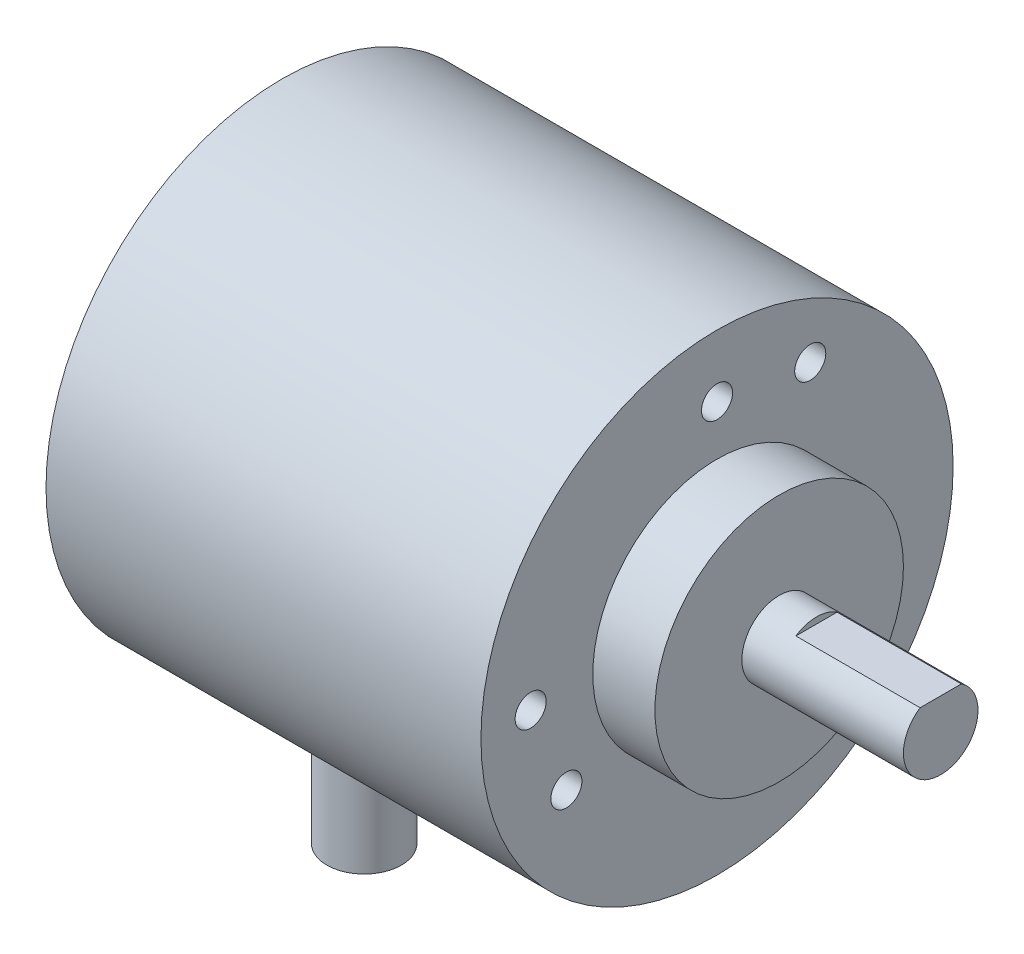
from build123d import *
from build123d.topology import SkipClean

# Parameters (mm, degrees)
SKETCH1_R                            = 19
BOSS_EXTRUDE1_DEPTH                  = 35
SKETCH2_R                            = 10
BOSS_EXTRUDE2_DEPTH                  = 5
SKETCH3_R                            = 3
BOSS_EXTRUDE3_DEPTH                  = 13
SKETCH4_W                            = 10.869693714
SKETCH4_H                            = 3.318117029
CUT_EXTRUDE1_DEPTH                   = 10
SKETCH5_R                            = 5
BOSS_EXTRUDE4_DEPTH                  = 2
BOSS_EXTRUDE4_DIRECTION_2_REACH      = 69.926
BOSS_EXTRUDE4_DIRECTION_2_END_RADIUS = 19
SKETCH6_R                            = 3
BOSS_EXTRUDE5_DEPTH                  = 10
M3_TAPPED_HOLE1_AT_2_COUNT           = 2
M3_TAPPED_HOLE1_AT_2_PITCH           = 7.567650257
CIRPATTERN1_COUNT                    = 3


with BuildPart() as part:
    # Sketch1 → Boss-Extrude1 (new body)
    with BuildSketch(Plane(origin=(0, 0, 0), x_dir=(0, 0, -1), z_dir=(1, 0, 0))):
        Circle(SKETCH1_R)
    extrude(amount=BOSS_EXTRUDE1_DEPTH)

    # Sketch2 → Boss-Extrude2 (add)
    with BuildSketch(Plane(origin=(35, 0, 0), x_dir=(0, 0, -1), z_dir=(1, 0, 0))):
        Circle(SKETCH2_R)
    extrude(amount=BOSS_EXTRUDE2_DEPTH)

    # Sketch3 → Boss-Extrude3 (add)
    with BuildSketch(Plane(origin=(40, 0, 0), x_dir=(0, 0, -1), z_dir=(1, 0, 0))):
        with Locations(Location((0, 0, 0), (0, 0, 180))):
            Circle(SKETCH3_R)
    extrude(amount=BOSS_EXTRUDE3_DEPTH)

    # Sketch4 → Cut-Extrude1 (cut)
    with BuildSketch(Plane(origin=(53, 0, 0), x_dir=(0, 0, -1), z_dir=(1, 0, 0))):
        with Locations((-0.046103434, 4.159058514)):
            Rectangle(SKETCH4_W, SKETCH4_H)
    extrude(amount=-CUT_EXTRUDE1_DEPTH, mode=Mode.SUBTRACT)

    # Sketch5 → Boss-Extrude4 (add)
    with BuildSketch(Plane(origin=(0, -19, 0), x_dir=(-1, 0, 0), z_dir=(0, -1, 0))):
        with Locations(Location((-6.604465085, 0, 0), (0, 0, 270))):
            Circle(SKETCH5_R)
    extrude(amount=BOSS_EXTRUDE4_DEPTH)

    # Boss-Extrude4 direction 2: up to this cylinder (the profile starts outside it)
    with SkipClean():  # the faces are left unmerged after this step: merging them gives an invalid solid
        boss_extrude4_direction_2_end = Plane(origin=(6.604465, 0, 0), z_dir=(-1, 0, 0)) * Cylinder(BOSS_EXTRUDE4_DIRECTION_2_END_RADIUS, 178.852, mode=Mode.PRIVATE)
        # Sketch5 → Boss-Extrude4 direction 2 (add, up to the surface)
        with BuildSketch(Plane(origin=(0, -19, 0), x_dir=(-1, 0, 0), z_dir=(0, -1, 0)), mode=Mode.PRIVATE) as boss_extrude4_direction_2_sk1:
            with Locations(Location((-6.604465085, 0, 0), (0, 0, 270))):
                Circle(SKETCH5_R)
        boss_extrude4_direction_2_tool1 = extrude(boss_extrude4_direction_2_sk1.sketch, amount=-BOSS_EXTRUDE4_DIRECTION_2_REACH, mode=Mode.PRIVATE) - boss_extrude4_direction_2_end
        add(boss_extrude4_direction_2_tool1.solids().sort_by_distance((6.604465, -19, 0))[0])
        add(boss_extrude4_direction_2_tool1.solids().sort_by_distance((6.604465, -19, 0))[1])

    # Sketch6 → Boss-Extrude5 (add)
    with BuildSketch(Plane.XZ.offset(21)):
        with Locations(Location((6.604465085, 0, 0), (0, 0, 270))):
            Circle(SKETCH6_R)
    extrude(amount=BOSS_EXTRUDE5_DEPTH)

    # Sketch10 → M3 Tapped Hole1 (revolve, cut)
    with BuildSketch(Plane(origin=(35, 12.990381057, -7.5), x_dir=(0, 0, -1), z_dir=(0, 1, 0))):
        Polygon((0, 0), (0, 8.251075774), (1.25, 7.5), (1.25, 0), align=None)
    m3_tapped_hole1 = revolve(axis=Axis((41.35, 12.990381057, -7.5), (-1, 0, 0)), mode=Mode.SUBTRACT)

    # M3 Tapped Hole1 at 2: M3 Tapped Hole1 ×2
    with Locations(*[Vector(0, 0.13341247401263537, 0.9910605994477977) * (i * M3_TAPPED_HOLE1_AT_2_PITCH) for i in range(1, M3_TAPPED_HOLE1_AT_2_COUNT)]):
        add(m3_tapped_hole1, mode=Mode.SUBTRACT)

    # CirPattern1: M3 Tapped Hole1 ×3 about axis
    cirpattern1_axis = Axis((0, 0, 0), (1, 0, 0))
    for i in range(1, CIRPATTERN1_COUNT):
        add(m3_tapped_hole1.rotate(cirpattern1_axis, i * 360 / CIRPATTERN1_COUNT), mode=Mode.SUBTRACT)

    # CirPattern1 copy 1 sketch → CirPattern1 copy 1 (revolve, cut)
    with BuildSketch(Plane(origin=(35, -7, 12.124355653), x_dir=(0, 0.8660254037844387, 0.4999999999999998), z_dir=(0, -0.4999999999999998, 0.8660254037844387))):
        Polygon((0, 0), (0, 8.251075774), (1.25, 7.5), (1.25, 0), align=None)
    revolve(axis=Axis((41.35, -7, 12.124355653), (-1, 0, 0)), mode=Mode.SUBTRACT)

    # CirPattern1 copy 2 sketch → CirPattern1 copy 2 (revolve, cut)
    with BuildSketch(Plane(origin=(35, -7, -12.124355653), x_dir=(0, -0.8660254037844384, 0.5000000000000004), z_dir=(0, -0.5000000000000004, -0.8660254037844384))):
        Polygon((0, 0), (0, 8.251075774), (1.25, 7.5), (1.25, 0), align=None)
    revolve(axis=Axis((41.35, -7, -12.124355653), (-1, 0, 0)), mode=Mode.SUBTRACT)


solid = part.part
